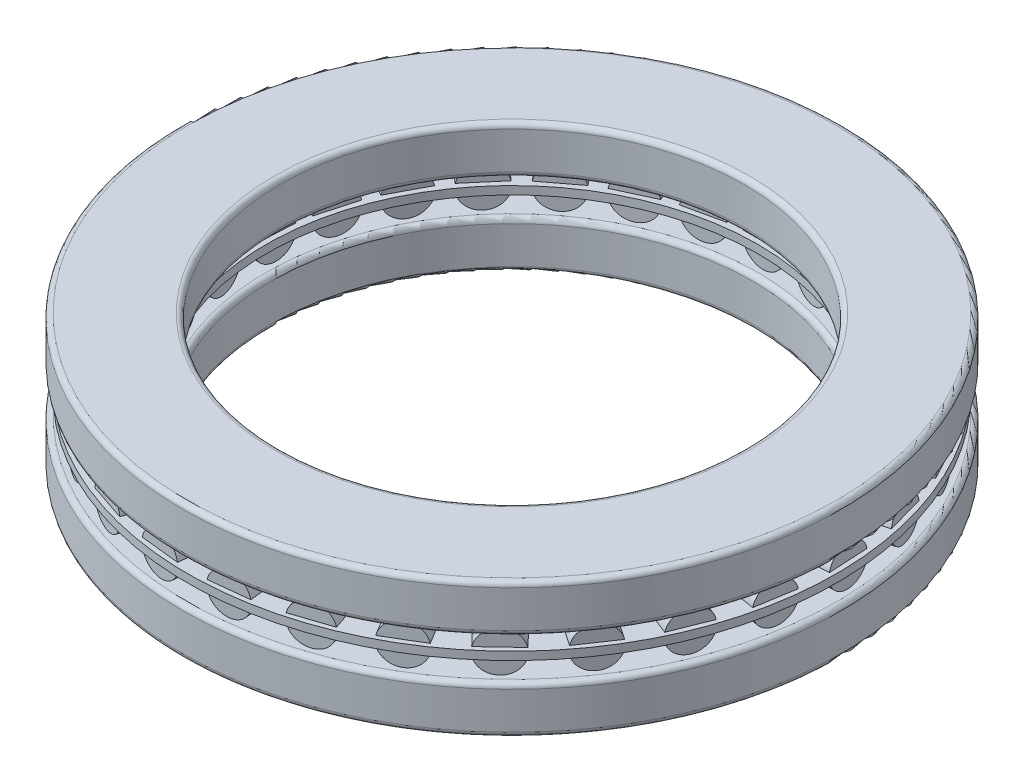
from build123d import *

# Parameters (mm, degrees)
SKETCH_7_W               = 9.3
SKETCH_7_H               = 0.96
SKETCH_4_3_W             = 2.4
SKETCH_4_3_H             = 8.1
PATTERN_CIRCULAR_2_COUNT = 29
SKETCH_4_W               = 2.4
SKETCH_4_H               = 8.1
PATTERN_CIRCULAR_1_COUNT = 29


with BuildPart() as part:
    # 草图2 → 旋转1 (revolve)
    with BuildSketch(Plane(origin=(0, 0, 0), x_dir=(0, 0, -1), z_dir=(1, 0, 0))):
        with BuildLine():
            Line((29.1, 2.8), (38.4, 2.8))
            ThreePointArc((38.4, 2.8), (38.824264069, 2.624264069), (39, 2.2))
            Line((39, 2.2), (39, -2.2))
            ThreePointArc((39, -2.2), (38.824264069, -2.624264069), (38.4, -2.8))
            Line((38.4, -2.8), (29.1, -2.8))
            ThreePointArc((29.1, -2.8), (28.675735931, -2.624264069), (28.5, -2.2))
            Line((28.5, -2.2), (28.5, 2.2))
            ThreePointArc((28.5, 2.2), (28.675735931, 2.624264069), (29.1, 2.8))
        make_face()
    revolve(axis=Axis((0, 0, 0), (0, 1, 0)))


with BuildPart() as body_2:
    # 草图3 → 旋转2 (revolve)
    with BuildSketch(Plane(origin=(0, 0, 0), x_dir=(0, 0, -1), z_dir=(1, 0, 0))):
        with BuildLine():
            Line((28.1, 13.2), (38.4, 13.2))
            ThreePointArc((38.4, 13.2), (38.824264069, 13.024264069), (39, 12.6))
            Line((39, 12.6), (39, 8.2))
            ThreePointArc((39, 8.2), (38.824264069, 7.775735931), (38.4, 7.6))
            Line((38.4, 7.6), (28.1, 7.6))
            ThreePointArc((28.1, 7.6), (27.675735931, 7.775735931), (27.5, 8.2))
            Line((27.5, 8.2), (27.5, 12.6))
            ThreePointArc((27.5, 12.6), (27.675735931, 13.024264069), (28.1, 13.2))
        make_face()
    revolve(axis=Axis((0, 0, 0), (0, 1, 0)))


with BuildPart() as body_3:
    # 草图7 → 旋转4 (revolve)
    with BuildSketch(Plane(origin=(0, 0, 0), x_dir=(0, 0, -1), z_dir=(1, 0, 0))):
        with Locations((33.75, 5.2)):
            Rectangle(SKETCH_7_W, SKETCH_7_H)
    revolve(axis=Axis((0, 0, 0), (0, 1, 0)))

    # 草图4<3> → 切除-旋转1 (revolve, cut)
    with BuildSketch(Plane.XZ.offset(-5.2)):
        with Locations((-1.2, -33.75)):
            Rectangle(SKETCH_4_3_W, SKETCH_4_3_H)
    cut_revolve_1 = revolve(axis=Axis((0, 5.2, 0), (0, 0, -1)), mode=Mode.SUBTRACT)

    # 阵列(圆周)2: 切除-旋转1 ×29 about axis
    pattern_circular_2_axis = Axis((0, 0, 0), (0, -1, 0))
    for i in range(1, PATTERN_CIRCULAR_2_COUNT):
        add(cut_revolve_1.rotate(pattern_circular_2_axis, i * 360 / PATTERN_CIRCULAR_2_COUNT), mode=Mode.SUBTRACT)


with BuildPart() as body_4:
    # 草图4 → 旋转3 (revolve)
    with BuildSketch(Plane.XZ.offset(-5.2)):
        with Locations((-1.2, -33.75)):
            Rectangle(SKETCH_4_W, SKETCH_4_H)
    revolve(axis=Axis((0, 5.2, 0), (0, 0, -1)))


with BuildPart() as pattern_circular_1_1:
    # 阵列(圆周)1: pattern copy
    add(body_4.part.rotate(Axis((0, 0, 0), (0, -1, 0)), 1 * 360 / PATTERN_CIRCULAR_1_COUNT))


with BuildPart() as pattern_circular_1_2:
    # 阵列(圆周)1: pattern copy
    add(body_4.part.rotate(Axis((0, 0, 0), (0, -1, 0)), 2 * 360 / PATTERN_CIRCULAR_1_COUNT))


with BuildPart() as pattern_circular_1_3:
    # 阵列(圆周)1: pattern copy
    add(body_4.part.rotate(Axis((0, 0, 0), (0, -1, 0)), 3 * 360 / PATTERN_CIRCULAR_1_COUNT))


with BuildPart() as pattern_circular_1_4:
    # 阵列(圆周)1: pattern copy
    add(body_4.part.rotate(Axis((0, 0, 0), (0, -1, 0)), 4 * 360 / PATTERN_CIRCULAR_1_COUNT))


with BuildPart() as pattern_circular_1_5:
    # 阵列(圆周)1: pattern copy
    add(body_4.part.rotate(Axis((0, 0, 0), (0, -1, 0)), 5 * 360 / PATTERN_CIRCULAR_1_COUNT))


with BuildPart() as pattern_circular_1_6:
    # 阵列(圆周)1: pattern copy
    add(body_4.part.rotate(Axis((0, 0, 0), (0, -1, 0)), 6 * 360 / PATTERN_CIRCULAR_1_COUNT))


with BuildPart() as pattern_circular_1_7:
    # 阵列(圆周)1: pattern copy
    add(body_4.part.rotate(Axis((0, 0, 0), (0, -1, 0)), 7 * 360 / PATTERN_CIRCULAR_1_COUNT))


with BuildPart() as pattern_circular_1_8:
    # 阵列(圆周)1: pattern copy
    add(body_4.part.rotate(Axis((0, 0, 0), (0, -1, 0)), 8 * 360 / PATTERN_CIRCULAR_1_COUNT))


with BuildPart() as pattern_circular_1_9:
    # 阵列(圆周)1: pattern copy
    add(body_4.part.rotate(Axis((0, 0, 0), (0, -1, 0)), 9 * 360 / PATTERN_CIRCULAR_1_COUNT))


with BuildPart() as pattern_circular_1_10:
    # 阵列(圆周)1: pattern copy
    add(body_4.part.rotate(Axis((0, 0, 0), (0, -1, 0)), 10 * 360 / PATTERN_CIRCULAR_1_COUNT))


with BuildPart() as pattern_circular_1_11:
    # 阵列(圆周)1: pattern copy
    add(body_4.part.rotate(Axis((0, 0, 0), (0, -1, 0)), 11 * 360 / PATTERN_CIRCULAR_1_COUNT))


with BuildPart() as pattern_circular_1_12:
    # 阵列(圆周)1: pattern copy
    add(body_4.part.rotate(Axis((0, 0, 0), (0, -1, 0)), 12 * 360 / PATTERN_CIRCULAR_1_COUNT))


with BuildPart() as pattern_circular_1_13:
    # 阵列(圆周)1: pattern copy
    add(body_4.part.rotate(Axis((0, 0, 0), (0, -1, 0)), 13 * 360 / PATTERN_CIRCULAR_1_COUNT))


with BuildPart() as pattern_circular_1_14:
    # 阵列(圆周)1: pattern copy
    add(body_4.part.rotate(Axis((0, 0, 0), (0, -1, 0)), 14 * 360 / PATTERN_CIRCULAR_1_COUNT))


with BuildPart() as pattern_circular_1_15:
    # 阵列(圆周)1: pattern copy
    add(body_4.part.rotate(Axis((0, 0, 0), (0, -1, 0)), 15 * 360 / PATTERN_CIRCULAR_1_COUNT))


with BuildPart() as pattern_circular_1_16:
    # 阵列(圆周)1: pattern copy
    add(body_4.part.rotate(Axis((0, 0, 0), (0, -1, 0)), 16 * 360 / PATTERN_CIRCULAR_1_COUNT))


with BuildPart() as pattern_circular_1_17:
    # 阵列(圆周)1: pattern copy
    add(body_4.part.rotate(Axis((0, 0, 0), (0, -1, 0)), 17 * 360 / PATTERN_CIRCULAR_1_COUNT))


with BuildPart() as pattern_circular_1_18:
    # 阵列(圆周)1: pattern copy
    add(body_4.part.rotate(Axis((0, 0, 0), (0, -1, 0)), 18 * 360 / PATTERN_CIRCULAR_1_COUNT))


with BuildPart() as pattern_circular_1_19:
    # 阵列(圆周)1: pattern copy
    add(body_4.part.rotate(Axis((0, 0, 0), (0, -1, 0)), 19 * 360 / PATTERN_CIRCULAR_1_COUNT))


with BuildPart() as pattern_circular_1_20:
    # 阵列(圆周)1: pattern copy
    add(body_4.part.rotate(Axis((0, 0, 0), (0, -1, 0)), 20 * 360 / PATTERN_CIRCULAR_1_COUNT))


with BuildPart() as pattern_circular_1_21:
    # 阵列(圆周)1: pattern copy
    add(body_4.part.rotate(Axis((0, 0, 0), (0, -1, 0)), 21 * 360 / PATTERN_CIRCULAR_1_COUNT))


with BuildPart() as pattern_circular_1_22:
    # 阵列(圆周)1: pattern copy
    add(body_4.part.rotate(Axis((0, 0, 0), (0, -1, 0)), 22 * 360 / PATTERN_CIRCULAR_1_COUNT))


with BuildPart() as pattern_circular_1_23:
    # 阵列(圆周)1: pattern copy
    add(body_4.part.rotate(Axis((0, 0, 0), (0, -1, 0)), 23 * 360 / PATTERN_CIRCULAR_1_COUNT))


with BuildPart() as pattern_circular_1_24:
    # 阵列(圆周)1: pattern copy
    add(body_4.part.rotate(Axis((0, 0, 0), (0, -1, 0)), 24 * 360 / PATTERN_CIRCULAR_1_COUNT))


with BuildPart() as pattern_circular_1_25:
    # 阵列(圆周)1: pattern copy
    add(body_4.part.rotate(Axis((0, 0, 0), (0, -1, 0)), 25 * 360 / PATTERN_CIRCULAR_1_COUNT))


with BuildPart() as pattern_circular_1_26:
    # 阵列(圆周)1: pattern copy
    add(body_4.part.rotate(Axis((0, 0, 0), (0, -1, 0)), 26 * 360 / PATTERN_CIRCULAR_1_COUNT))


with BuildPart() as pattern_circular_1_27:
    # 阵列(圆周)1: pattern copy
    add(body_4.part.rotate(Axis((0, 0, 0), (0, -1, 0)), 27 * 360 / PATTERN_CIRCULAR_1_COUNT))


with BuildPart() as pattern_circular_1_28:
    # 阵列(圆周)1: pattern copy
    add(body_4.part.rotate(Axis((0, 0, 0), (0, -1, 0)), 28 * 360 / PATTERN_CIRCULAR_1_COUNT))


solid = Compound([part.part, body_2.part, body_3.part, body_4.part, pattern_circular_1_1.part, pattern_circular_1_2.part, pattern_circular_1_3.part, pattern_circular_1_4.part, pattern_circular_1_5.part, pattern_circular_1_6.part, pattern_circular_1_7.part, pattern_circular_1_8.part, pattern_circular_1_9.part, pattern_circular_1_10.part, pattern_circular_1_11.part, pattern_circular_1_12.part, pattern_circular_1_13.part, pattern_circular_1_14.part, pattern_circular_1_15.part, pattern_circular_1_16.part, pattern_circular_1_17.part, pattern_circular_1_18.part, pattern_circular_1_19.part, pattern_circular_1_20.part, pattern_circular_1_21.part, pattern_circular_1_22.part, pattern_circular_1_23.part, pattern_circular_1_24.part, pattern_circular_1_25.part, pattern_circular_1_26.part, pattern_circular_1_27.part, pattern_circular_1_28.part])
